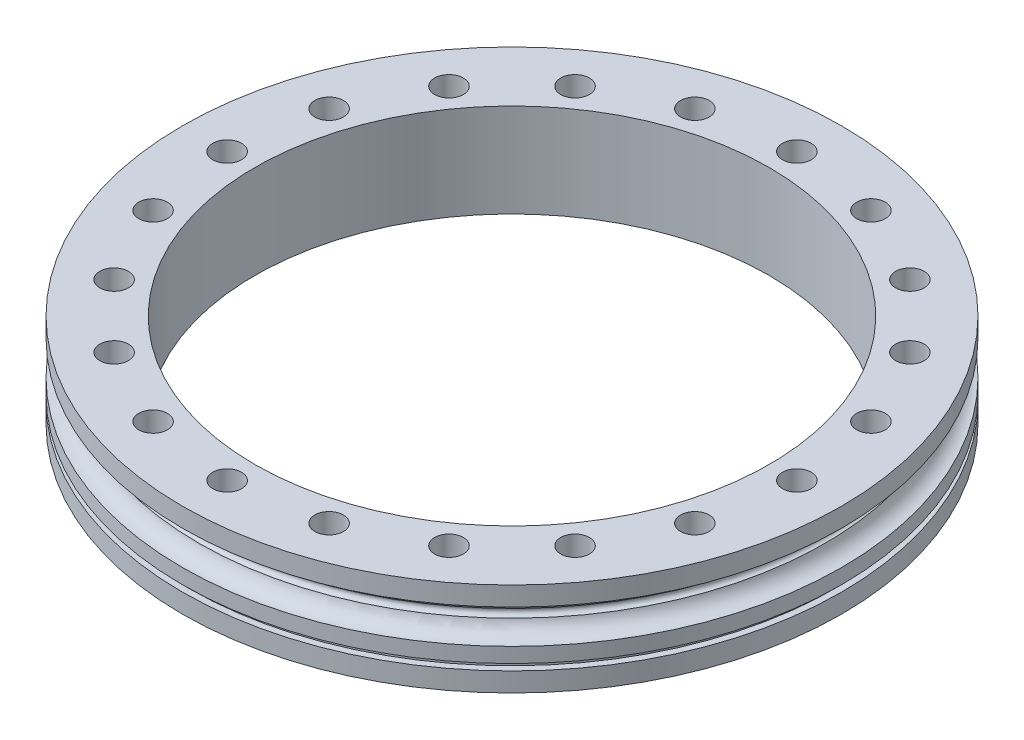
from build123d import *

# Parameters (mm, degrees)
ESQUISSE4_R             = 6.75
ENL_V_MAT_EXTRU_2_DEPTH = 224.575490607


with BuildPart() as part:
    # Esquisse1 → Révolution1 (revolve)
    with BuildSketch(Plane.XY, mode=Mode.PRIVATE) as r_volution1_sk:
        with BuildLine():
            Line((-155, 23), (-155, 32))
            Line((-155, 32), (-121, 32))
            Line((-121, 32), (-121, -12))
            Line((-121, -12), (-155, -12))
            Line((-155, -12), (-155, -3))
            Line((-155, -3), (-152, -3))
            Line((-152, -3), (-152, 0))
            Line((-152, 0), (-155, 0))
            Line((-155, 0), (-155, 7))
            ThreePointArc((-155, 7), (-150.094620701, 8.680407139), (-147.25, 13.015686517))
            ThreePointArc((-147.25, 13.015686517), (-145.5, 15), (-147.25, 16.984313483))
            ThreePointArc((-147.25, 16.984313483), (-150.094620701, 21.319592861), (-155, 23))
        make_face()
    revolve(r_volution1_sk.sketch.rotate(Axis((0, 44, 0), (0, -1, 0)), 270), axis=Axis((0, 44, 0), (0, -1, 0)))

    # Esquisse4 → Enlèv. mat.-Extru.2 (cut, through all)
    with BuildSketch(Plane(origin=(0, 32, 0), x_dir=(1, 0, 0), z_dir=(0, 1, 0))):
        with Locations(Location((-134, 0, 0), (0, 0, 270))):
            Circle(ESQUISSE4_R)
        with Locations(Location((-127.441573184, 41.408277246, 0), (0, 0, 270))):
            Circle(ESQUISSE4_R)
        with Locations(Location((-108.408277246, 78.763223807, 0), (0, 0, 270))):
            Circle(ESQUISSE4_R)
        with Locations(Location((-78.763223807, 108.408277246, 0), (0, 0, 270))):
            Circle(ESQUISSE4_R)
        with Locations(Location((-41.408277246, 127.441573184, 0), (0, 0, 270))):
            Circle(ESQUISSE4_R)
        with Locations(Location((0, 134, 0), (0, 0, 270))):
            Circle(ESQUISSE4_R)
        with Locations(Location((41.408277246, 127.441573184, 0), (0, 0, 270))):
            Circle(ESQUISSE4_R)
        with Locations(Location((78.763223807, 108.408277246, 0), (0, 0, 270))):
            Circle(ESQUISSE4_R)
        with Locations(Location((108.408277246, 78.763223807, 0), (0, 0, 270))):
            Circle(ESQUISSE4_R)
        with Locations(Location((127.441573184, 41.408277246, 0), (0, 0, 270))):
            Circle(ESQUISSE4_R)
        with Locations(Location((134, 0, 0), (0, 0, 270))):
            Circle(ESQUISSE4_R)
        with Locations(Location((127.441573184, -41.408277246, 0), (0, 0, 270))):
            Circle(ESQUISSE4_R)
        with Locations(Location((108.408277246, -78.763223807, 0), (0, 0, 270))):
            Circle(ESQUISSE4_R)
        with Locations(Location((78.763223807, -108.408277246, 0), (0, 0, 270))):
            Circle(ESQUISSE4_R)
        with Locations(Location((41.408277246, -127.441573184, 0), (0, 0, 270))):
            Circle(ESQUISSE4_R)
        with Locations(Location((0, -134, 0), (0, 0, 270))):
            Circle(ESQUISSE4_R)
        with Locations(Location((-41.408277246, -127.441573184, 0), (0, 0, 270))):
            Circle(ESQUISSE4_R)
        with Locations(Location((-78.763223807, -108.408277246, 0), (0, 0, 270))):
            Circle(ESQUISSE4_R)
        with Locations(Location((-108.408277246, -78.763223807, 0), (0, 0, 270))):
            Circle(ESQUISSE4_R)
        with Locations(Location((-127.441573184, -41.408277246, 0), (0, 0, 270))):
            Circle(ESQUISSE4_R)
    extrude(amount=-ENL_V_MAT_EXTRU_2_DEPTH, mode=Mode.SUBTRACT)


solid = part.part
